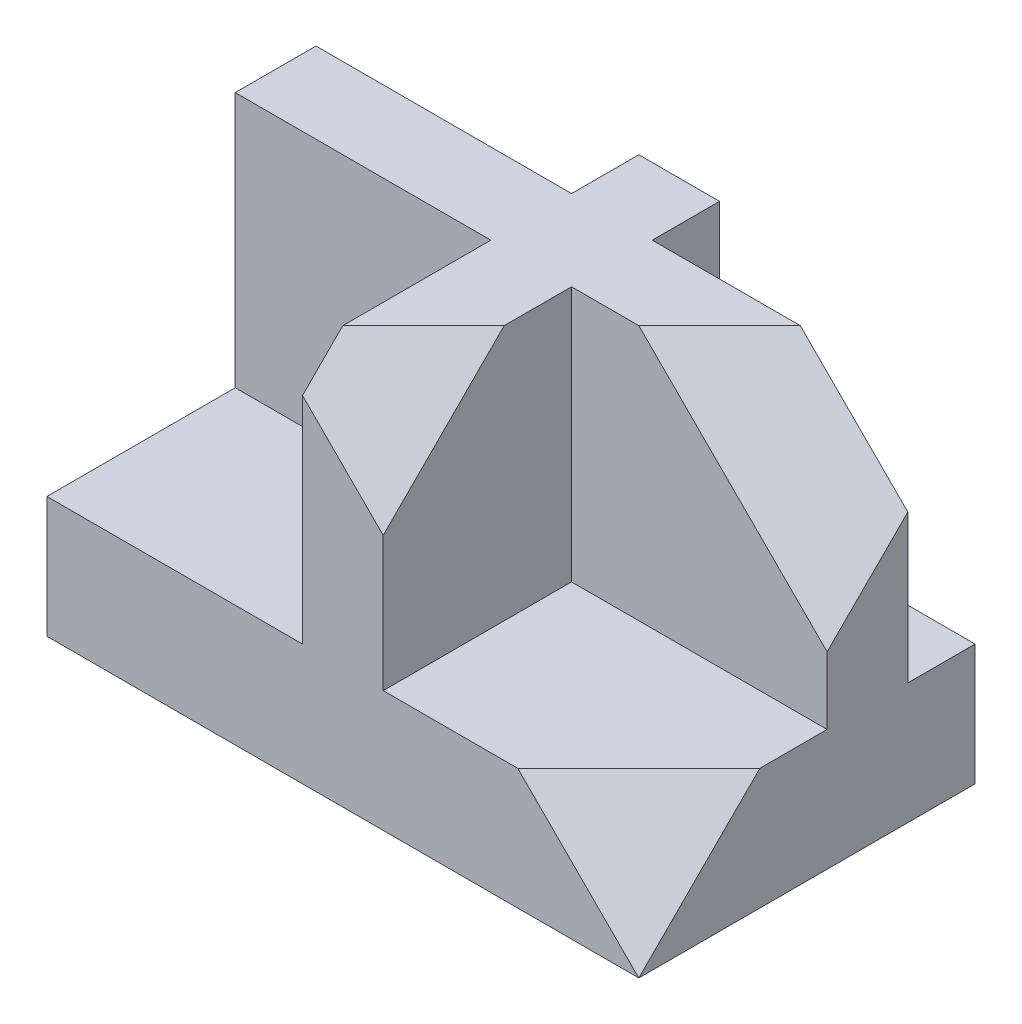
from build123d import *

# Parameters (mm, degrees)
SKETCH1_W           = 38
SKETCH1_H           = 10
SKETCH1_H_2         = 12
SKETCH1_W_2         = 12
SKETCH1_H_3         = 28
BOSS_EXTRUDE1_DEPTH = 18
SKETCH1_3_W         = 38
SKETCH1_3_H         = 12
SKETCH1_3_W_2       = 12
SKETCH1_3_H_2       = 28
SKETCH1_3_H_3       = 10
BOSS_EXTRUDE2_DEPTH = 38


with BuildPart() as part:
    # Sketch1 → Boss-Extrude1 (new body)
    with BuildSketch(Plane(origin=(0, 0, 0), x_dir=(1, 0, 0), z_dir=(0, 1, 0))):
        with Locations((25, 20)):
            Rectangle(SKETCH1_W, SKETCH1_H)
        with Locations((25, 9)):
            Rectangle(SKETCH1_W, SKETCH1_H_2)
        with Locations((0, 9)):
            Rectangle(SKETCH1_W_2, SKETCH1_H_2)
        with Locations((25, -11)):
            Rectangle(SKETCH1_W, SKETCH1_H_3)
        with Locations((0, -11)):
            Rectangle(SKETCH1_W_2, SKETCH1_H_3)
        with Locations((-25, -11)):
            Rectangle(SKETCH1_W, SKETCH1_H_3)
        with Locations((-25, 9)):
            Rectangle(SKETCH1_W, SKETCH1_H_2)
        with Locations((-25, 20)):
            Rectangle(SKETCH1_W, SKETCH1_H)
        with Locations((0, 20)):
            Rectangle(SKETCH1_W_2, SKETCH1_H)
    extrude(amount=-BOSS_EXTRUDE1_DEPTH)

    # Sketch1<3> → Boss-Extrude2 (add)
    with BuildSketch(Plane(origin=(0, 0, 0), x_dir=(1, 0, 0), z_dir=(0, 1, 0))):
        with Locations((-25, 9)):
            Rectangle(SKETCH1_3_W, SKETCH1_3_H)
        with Locations((0, 9)):
            Rectangle(SKETCH1_3_W_2, SKETCH1_3_H)
        with Locations((25, 9)):
            Rectangle(SKETCH1_3_W, SKETCH1_3_H)
        with Locations((0, -11)):
            Rectangle(SKETCH1_3_W_2, SKETCH1_3_H_2)
        with Locations((0, 20)):
            Rectangle(SKETCH1_3_W_2, SKETCH1_3_H_3)
    extrude(amount=BOSS_EXTRUDE2_DEPTH)

    # SurfaceCut5
    split(bisect_by=Plane(origin=(17, 17, 17), x_dir=(0.8164965809277277, -0.4082482904638635, -0.4082482904638593), z_dir=(0.5773502691896235, 0.57735026918963, 0.577350269189624)), keep=Keep.BOTTOM)


solid = part.part
